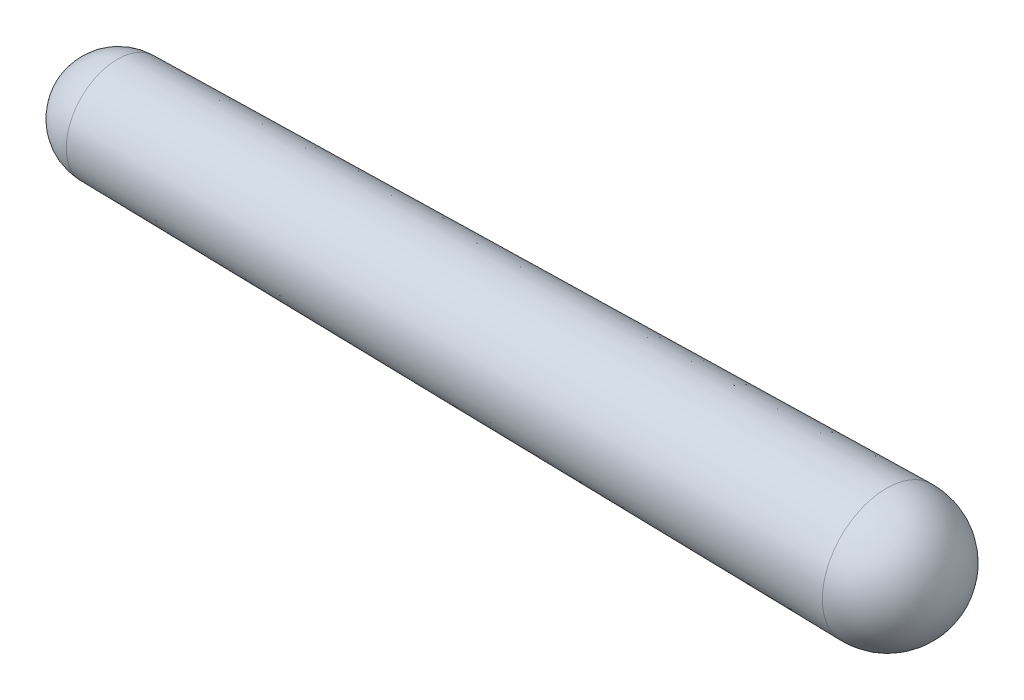
from build123d import *


with BuildPart() as part:
    # Sketch1 → Revolve1 (revolve)
    with BuildSketch(Plane(origin=(0, 0, 0), x_dir=(1, 0, 0), z_dir=(0, 1, 0))):
        with BuildLine():
            Line((-30.033333333, 1.999722203), (-0.041666667, 2.499652754))
            ThreePointArc((-0.041666667, 2.499652754), (1.752973664, 1.78243747), (2.5, 0))
            Line((2.5, 0), (-32, 0))
            ThreePointArc((-32, 0), (-31.425949976, 1.402378931), (-30.033333333, 1.999722203))
        make_face()
    revolve(axis=Axis((-32, 0, 0), (1, 0, 0)))


solid = part.part
